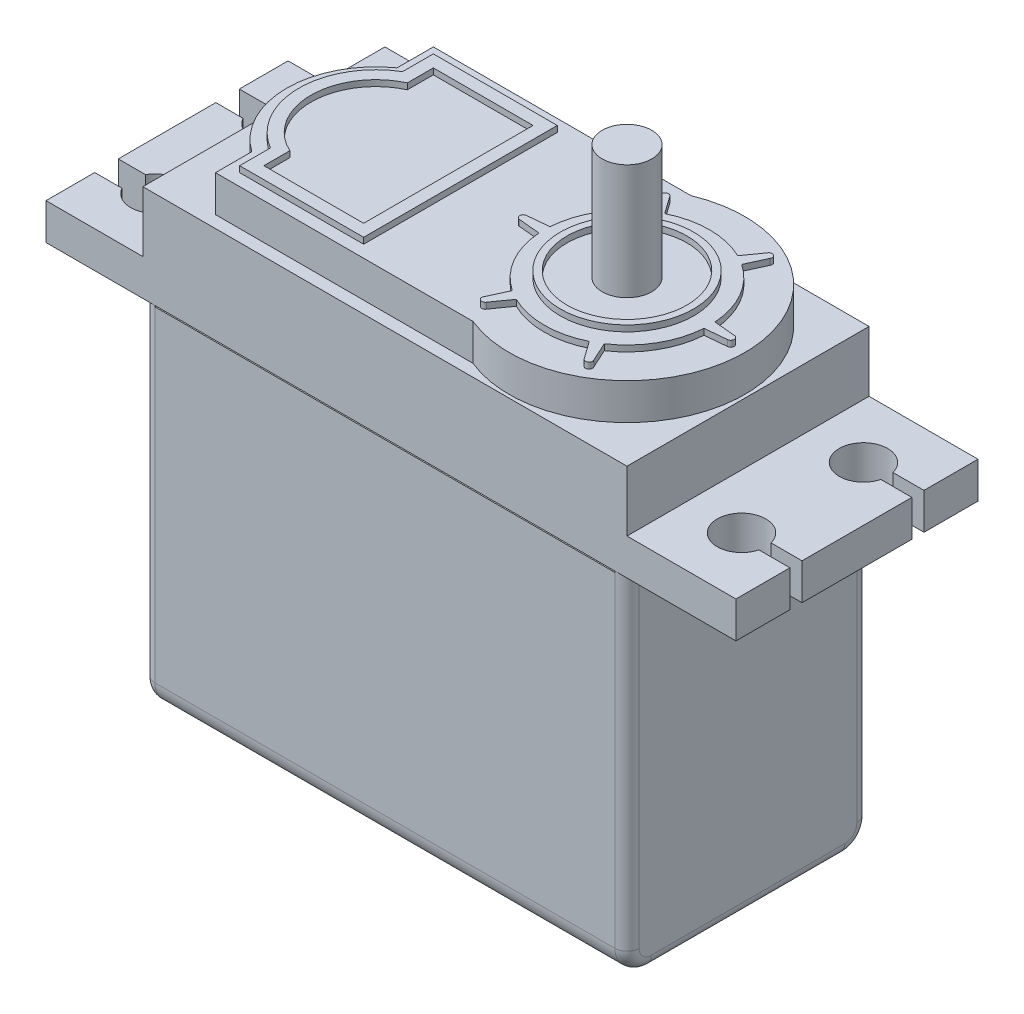
from build123d import *

# Parameters (mm, degrees)
SKETCH1_W            = 57
SKETCH1_H            = 20
BOSS_EXTRUDE2_DEPTH  = 3
SKETCH3_W            = 40
SKETCH3_H            = 20
BOSS_EXTRUDE3_DEPTH  = 27
SKETCH4_W            = 40
SKETCH4_H            = 20
BOSS_EXTRUDE4_DEPTH  = 5
SKETCH7_R            = 2.049783944
BOSS_EXTRUDE5_DEPTH  = 3
SKETCH8_W            = 40
SKETCH8_H            = 20
BOSS_EXTRUDE6_DEPTH  = 2
FILLET1_R            = 2
FILLET3_R            = 1
CUT_EXTRUDE1_DEPTH   = 12
CUT_EXTRUDE2_DEPTH   = 12
SKETCH12_R           = 2.049783944
BOSS_EXTRUDE7_DEPTH  = 10
SKETCH13_W           = 38
SKETCH13_H           = 0.1
CUT_EXTRUDE3_DEPTH   = 0.1
SKETCH14_W           = 18
SKETCH14_H           = 0.1
CUT_EXTRUDE4_DEPTH   = 0.1
SKETCH16_W           = 18
SKETCH16_H           = 0.1
BOSS_EXTRUDE10_DEPTH = 0.1
BOSS_EXTRUDE13_DEPTH = 0.5
SKETCH18_R           = 5.505741297
SKETCH18_R_2         = 4.954025226
BOSS_EXTRUDE14_DEPTH = 0.5
BOSS_EXTRUDE15_DEPTH = 0.5
SKETCH22_R           = 2.049783944
BOSS_EXTRUDE17_DEPTH = 0.01


with BuildPart() as part:
    # Sketch1 → Boss-Extrude2 (new body)
    with BuildSketch(Plane(origin=(0, 0, 0), x_dir=(1, 0, 0), z_dir=(0, 1, 0))):
        with Locations((2.775361092, -10)):
            Rectangle(SKETCH1_W, SKETCH1_H)
    extrude(amount=BOSS_EXTRUDE2_DEPTH)

    # Sketch3 → Boss-Extrude3 (add)
    with BuildSketch(Plane.XZ):
        with Locations((2.275361092, 10)):
            Rectangle(SKETCH3_W, SKETCH3_H)
    extrude(amount=BOSS_EXTRUDE3_DEPTH)

    # Sketch4 → Boss-Extrude4 (add)
    with BuildSketch(Plane(origin=(0, 3, 0), x_dir=(1, 0, 0), z_dir=(0, 1, 0))):
        with Locations((2.275361092, -10)):
            Rectangle(SKETCH4_W, SKETCH4_H)
    extrude(amount=BOSS_EXTRUDE4_DEPTH)

    # Sketch7 → Boss-Extrude5 (add)
    with BuildSketch(Plane(origin=(0, 8, 0), x_dir=(1, 0, 0), z_dir=(0, 1, 0))):
        with BuildLine():
            Line((8.555331619, -1), (-12.724638908, -1))
            Line((-12.724638908, -1), (-12.724638908, -4))
            ThreePointArc((-12.724638908, -4), (-15.83010298, -10), (-12.724638908, -16))
            Line((-12.724638908, -16), (-12.724638908, -19))
            Line((-12.724638908, -19), (8.555331619, -19))
            ThreePointArc((8.555331619, -19), (22.013873261, -10), (8.555331619, -1))
        make_face()
        with Locations(Location((12.275361092, -10, 0), (0, 0, 270))):
            Circle(SKETCH7_R, mode=Mode.SUBTRACT)
    extrude(amount=BOSS_EXTRUDE5_DEPTH)

    # Sketch8 → Boss-Extrude6 (add)
    with BuildSketch(Plane.XZ.offset(27)):
        with Locations((2.275361092, 10)):
            Rectangle(SKETCH8_W, SKETCH8_H)
    extrude(amount=BOSS_EXTRUDE6_DEPTH)

    # Fillet1
    fillet1_edges = [part.edges().sort_by_distance(p)[0] for p in [
        (2.275361092, -29, 20),
        (2.275361092, -29, 0),
    ]]
    fillet(fillet1_edges, radius=FILLET1_R)

    # Fillet3
    fillet3_edges = [part.edges().sort_by_distance(p)[0] for p in [
        (22.275361092, -29, 10),
        (-17.724638908, -29, 10),
        (-17.724638908, -13.5, 0),
        (-17.724638908, -13.5, 20),
        (-17.724638908, -28.414213562, 0.585786438),
        (-17.724638908, -28.414213562, 19.414213562),
        (22.275361092, -13.5, 20),
        (22.275361092, -13.5, 0),
        (22.275361092, -28.414213562, 0.585786438),
        (22.275361092, -28.414213562, 19.414213562),
    ]]
    fillet(fillet3_edges, radius=FILLET3_R)

    # Sketch9 → Cut-Extrude1 (cut)
    with BuildSketch(Plane(origin=(0, 3, 0), x_dir=(1, 0, 0), z_dir=(0, 1, 0))):
        with BuildLine():
            Line((-25.724638908, -15.974539408), (-25.724638908, -14.029117413))
            Line((-25.724638908, -14.029117413), (-23.473177442, -14.029117413))
            ThreePointArc((-23.473177442, -14.029117413), (-19.724640003, -14.997907425), (-23.47114197, -15.974539408))
            Line((-23.47114197, -15.974539408), (-25.724638908, -15.974539408))
        make_face()
        with BuildLine():
            Line((-23.47114197, -4.025460592), (-25.724638908, -4.025460592))
            Line((-25.724638908, -4.025460592), (-25.724638908, -5.970882587))
            Line((-25.724638908, -5.970882587), (-23.473177442, -5.970882587))
            ThreePointArc((-23.473177442, -5.970882587), (-19.724640003, -5.002092575), (-23.47114197, -4.025460592))
        make_face()
    extrude(amount=-CUT_EXTRUDE1_DEPTH, mode=Mode.SUBTRACT)

    # Sketch11 → Cut-Extrude2 (cut)
    with BuildSketch(Plane(origin=(0, 3, 0), x_dir=(1, 0, 0), z_dir=(0, 1, 0))):
        with BuildLine():
            Line((31.275361092, -5.46228452), (31.275361092, -4.46228452))
            Line((31.275361092, -4.46228452), (28.711852765, -4.46228452))
            ThreePointArc((28.711852765, -4.46228452), (24.775361092, -4.96228452), (28.711852765, -5.46228452))
            Line((28.711852765, -5.46228452), (31.275361092, -5.46228452))
        make_face()
        with BuildLine():
            Line((28.711852765, -14.53771548), (31.275361092, -14.53771548))
            Line((31.275361092, -14.53771548), (31.275361092, -15.53771548))
            Line((31.275361092, -15.53771548), (28.711852765, -15.53771548))
            ThreePointArc((28.711852765, -15.53771548), (24.775361092, -15.03771548), (28.711852765, -14.53771548))
        make_face()
    extrude(amount=-CUT_EXTRUDE2_DEPTH, mode=Mode.SUBTRACT)

    # Sketch13 → Cut-Extrude3 (cut)
    with BuildSketch(Plane.XY.offset(20)):
        with Locations((2.275361092, -0.05)):
            Rectangle(SKETCH13_W, SKETCH13_H)
    extrude(amount=-CUT_EXTRUDE3_DEPTH, mode=Mode.SUBTRACT)

    # Sketch14 → Cut-Extrude4 (cut)
    with BuildSketch(Plane(origin=(22.275361092, 0, 0), x_dir=(0, 0, -1), z_dir=(1, 0, 0))):
        with Locations((-10, -0.05)):
            Rectangle(SKETCH14_W, SKETCH14_H)
    extrude(amount=-CUT_EXTRUDE4_DEPTH, mode=Mode.SUBTRACT)

    # Sketch16 → Boss-Extrude10 (add)
    with BuildSketch(Plane.ZY.offset(17.724638908)):
        with Locations((10, -0.05)):
            Rectangle(SKETCH16_W, SKETCH16_H)
    extrude(amount=BOSS_EXTRUDE10_DEPTH)



with BuildPart() as body_2:
    # Sketch12 → Boss-Extrude7 (new body)
    with BuildSketch(Plane(origin=(0, 11, 0), x_dir=(1, 0, 0), z_dir=(0, 1, 0))):
        with Locations(Location((12.275361092, -10, 0), (0, 0, 270))):
            Circle(SKETCH12_R)
    extrude(amount=BOSS_EXTRUDE7_DEPTH)


with BuildPart() as part_1:
    add(part.part)

    add(body_2.part)  # Boss-Extrude13 merges body 2
    # Sketch17 → Boss-Extrude13 (add)
    with BuildSketch(Plane(origin=(0, 11, 0), x_dir=(1, 0, 0), z_dir=(0, 1, 0))):
        with BuildLine():
            Line((20.850118946, -10.288863052), (19.089941192, -10.454244634))
            ThreePointArc((19.089941192, -10.454244634), (18.190057204, -13.414851392), (16.076038534, -15.674477166))
            Line((16.076038534, -15.674477166), (16.81290276, -17.281526608))
            ThreePointArc((16.81290276, -17.281526608), (16.707171545, -17.676120875), (16.312577278, -17.57038966))
            Line((16.312577278, -17.57038966), (15.289263749, -16.1287218))
            ThreePointArc((15.289263749, -16.1287218), (12.275361092, -16.829702785), (9.261458434, -16.1287218))
            Line((9.261458434, -16.1287218), (8.238144905, -17.57038966))
            ThreePointArc((8.238144905, -17.57038966), (7.843550638, -17.676120875), (7.737819423, -17.281526608))
            Line((7.737819423, -17.281526608), (8.474683649, -15.674477166))
            ThreePointArc((8.474683649, -15.674477166), (6.360664979, -13.414851392), (5.460780991, -10.454244634))
            Line((5.460780991, -10.454244634), (3.700603237, -10.288863052))
            ThreePointArc((3.700603237, -10.288863052), (3.411740185, -10), (3.700603237, -9.711136948))
            Line((3.700603237, -9.711136948), (5.460780991, -9.545755366))
            ThreePointArc((5.460780991, -9.545755366), (6.360664979, -6.585148608), (8.474683649, -4.325522834))
            Line((8.474683649, -4.325522834), (7.737819423, -2.718473392))
            ThreePointArc((7.737819423, -2.718473392), (7.843550638, -2.323879125), (8.238144905, -2.42961034))
            Line((8.238144905, -2.42961034), (9.261458434, -3.8712782))
            ThreePointArc((9.261458434, -3.8712782), (12.275361092, -3.170297215), (15.289263749, -3.8712782))
            Line((15.289263749, -3.8712782), (16.312577278, -2.42961034))
            ThreePointArc((16.312577278, -2.42961034), (16.707171545, -2.323879125), (16.81290276, -2.718473392))
            Line((16.81290276, -2.718473392), (16.076038534, -4.325522834))
            ThreePointArc((16.076038534, -4.325522834), (18.190057204, -6.585148608), (19.089941192, -9.545755366))
            Line((19.089941192, -9.545755366), (20.850118946, -9.711136948))
            ThreePointArc((20.850118946, -9.711136948), (21.138981999, -10), (20.850118946, -10.288863052))
        make_face()
    extrude(amount=BOSS_EXTRUDE13_DEPTH)

    # Sketch18 → Boss-Extrude14 (add)
    with BuildSketch(Plane(origin=(0, 11.5, 0), x_dir=(1, 0, 0), z_dir=(0, 1, 0))):
        with Locations(Location((12.275361092, -10, 0), (0, 0, 270))):
            Circle(SKETCH18_R)
        with Locations(Location((12.275361092, -10, 0), (0, 0, 270))):
            Circle(SKETCH18_R_2, mode=Mode.SUBTRACT)
    extrude(amount=BOSS_EXTRUDE14_DEPTH)

    # Sketch20 → Boss-Extrude15 (add)
    with BuildSketch(Plane(origin=(0, 11, 0), x_dir=(1, 0, 0), z_dir=(0, 1, 0))):
        with BuildLine():
            Line((-1.482591904, -18), (-1.482591904, -2))
            Line((-1.482591904, -2), (-11.724638908, -2))
            Line((-11.724638908, -2), (-11.724638908, -4.542063407))
            ThreePointArc((-11.724638908, -4.542063407), (-14.83010298, -10), (-11.724638908, -15.457936593))
            Line((-11.724638908, -15.457936593), (-11.724638908, -18))
            Line((-11.724638908, -18), (-1.482591904, -18))
        make_face()
        with BuildLine():
            Line((-2.482591904, -3), (-10.724638908, -3))
            Line((-10.724638908, -3), (-10.724638908, -5.144266923))
            ThreePointArc((-10.724638908, -5.144266923), (-13.83010298, -10), (-10.724638908, -14.855733077))
            Line((-10.724638908, -14.855733077), (-10.724638908, -17))
            Line((-10.724638908, -17), (-2.482591904, -17))
            Line((-2.482591904, -17), (-2.482591904, -3))
        make_face(mode=Mode.SUBTRACT)
    extrude(amount=BOSS_EXTRUDE15_DEPTH)

    # Sketch22 → Boss-Extrude17 (add)
    with BuildSketch(Plane(origin=(0, 21, 0), x_dir=(1, 0, 0), z_dir=(0, 1, 0))):
        with Locations(Location((12.275361092, -10, 0), (0, 0, 270))):
            Circle(SKETCH22_R)
    extrude(amount=BOSS_EXTRUDE17_DEPTH)


solid = part_1.part
